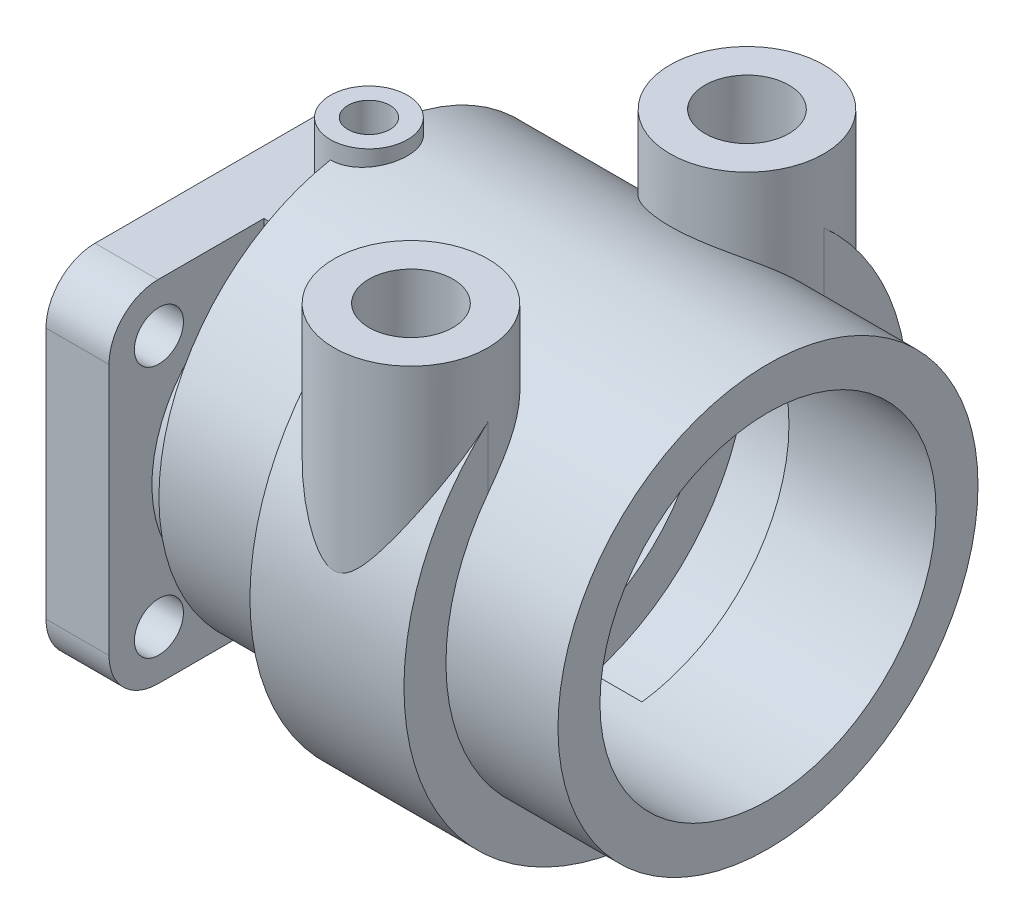
from build123d import *
from build123d.topology import SkipClean

# Parameters (mm, degrees)
SKETCH_1_R           = 3.5
EXTRUDE_1_DEPTH      = 9
SKETCH_2_R           = 19
CUT_EXTRUDE_1_DEPTH  = 5
SKETCH_3_R           = 19
EXTRUDE_2_DEPTH      = 12
SKETCH_4_R           = 11
CUT_EXTRUDE_2_DEPTH  = 22
SKETCH_6_R           = 30
EXTRUDE_4_DEPTH      = 57
SKETCH_9_R           = 24
CUT_EXTRUDE_3_DEPTH  = 51
SKETCH_10_R          = 11
CUT_EXTRUDE_4_DEPTH  = 22
EXTRUDE_5_DEPTH      = 42
EXTRUDE_5_DEPTH_BACK = 5
SKETCH_11_R          = 5.5
SKETCH_12_R          = 3
CUT_EXTRUDE_5_DEPTH  = 46
EXTRUDE_6_DEPTH      = 3
EXTRUDE_6_DEPTH_BACK = 3
SKETCH_13_W          = 9.793504726
SKETCH_13_H          = 10
SKETCH_14_R          = 11
EXTRUDE_7_DEPTH      = 46
SKETCH_15_R          = 11
EXTRUDE_8_DEPTH      = 46
SKETCH_16_R          = 5.5
CUT_EXTRUDE_6_DEPTH  = 46
SKETCH_17_R          = 5.5
CUT_EXTRUDE_8_DEPTH  = 53
SKETCH_18_R          = 11
CUT_EXTRUDE_9_DEPTH  = 10
SKETCH_19_R          = 11
CUT_EXTRUDE_10_DEPTH = 10
EXTRUDE_9_DEPTH      = 38
SKETCH_21_R          = 49.255208552
CUT_EXTRUDE_18_DEPTH = 16
SKETCH_22_R          = 30
EXTRUDE_10_DEPTH     = 16
SKETCH_23_R          = 24
CUT_EXTRUDE_19_DEPTH = 21
CUT_EXTRUDE_21_DEPTH = 12
SKETCH_25_R          = 24
CUT_EXTRUDE_22_DEPTH = 18.5
SKETCH_26_R          = 11
CUT_EXTRUDE_23_DEPTH = 31.5
SKETCH_27_R          = 6
CUT_EXTRUDE_24_DEPTH = 36
SKETCH_28_R          = 6
CUT_EXTRUDE_25_DEPTH = 36


with BuildPart() as part:
    # 草图1 → 凸台-拉伸1 (new body)
    with BuildSketch(Plane(origin=(0, 0, 0), x_dir=(0, 0, -1), z_dir=(1, 0, 0))):
        with BuildLine():
            Line((18.130000068, 25), (-18.130000068, 25))
            ThreePointArc((-18.130000068, 25), (-23.079747536, 22.949747468), (-25.130000068, 18))
            Line((-25.130000068, 18), (-25.130000068, -18))
            ThreePointArc((-25.130000068, -18), (-23.079747536, -22.949747468), (-18.130000068, -25))
            Line((-18.130000068, -25), (18.130000068, -25))
            ThreePointArc((18.130000068, -25), (23.079747536, -22.949747468), (25.130000068, -18))
            Line((25.130000068, -18), (25.130000068, 18))
            ThreePointArc((25.130000068, 18), (23.079747536, 22.949747468), (18.130000068, 25))
        make_face()
        with Locations((-18, 18)):
            Circle(SKETCH_1_R, mode=Mode.SUBTRACT)
        with Locations((-18, -18)):
            Circle(SKETCH_1_R, mode=Mode.SUBTRACT)
        with Locations((18, -18)):
            Circle(SKETCH_1_R, mode=Mode.SUBTRACT)
        with Locations((18, 18)):
            Circle(SKETCH_1_R, mode=Mode.SUBTRACT)
    extrude(amount=EXTRUDE_1_DEPTH)

    # 草图2 → 切除-拉伸1 (cut)
    with BuildSketch(Plane.ZY):
        Circle(SKETCH_2_R)
    extrude(amount=-CUT_EXTRUDE_1_DEPTH, mode=Mode.SUBTRACT)

    # 草图3 → 凸台-拉伸2 (add)
    with BuildSketch(Plane(origin=(9, 0, 0), x_dir=(0, 0, -1), z_dir=(1, 0, 0))):
        with Locations(Location((0, 0, 0), (0, 0, 180))):
            Circle(SKETCH_3_R)
    extrude(amount=EXTRUDE_2_DEPTH)

    # 草图4 → 切除-拉伸2 (cut)
    with BuildSketch(Plane.ZY.offset(-5)):
        Circle(SKETCH_4_R)
    extrude(amount=-CUT_EXTRUDE_2_DEPTH, mode=Mode.SUBTRACT)

    # 草图6 → 凸台-拉伸4 (add)
    with BuildSketch(Plane(origin=(21, 0, 0), x_dir=(0, 0, -1), z_dir=(1, 0, 0))):
        with Locations(Location((0, 10, 0), (0, 0, 180))):
            Circle(SKETCH_6_R)
    extrude(amount=EXTRUDE_4_DEPTH)

    # 草图9 → 切除-拉伸3 (cut)
    with BuildSketch(Plane(origin=(78, 0, 0), x_dir=(0, 0, -1), z_dir=(1, 0, 0))):
        with Locations((0, 10)):
            Circle(SKETCH_9_R)
    extrude(amount=-CUT_EXTRUDE_3_DEPTH, mode=Mode.SUBTRACT)

    # 草图10 → 切除-拉伸4 (cut)
    with BuildSketch(Plane.ZY.offset(-5)):
        Circle(SKETCH_10_R)
    extrude(amount=-CUT_EXTRUDE_4_DEPTH, mode=Mode.SUBTRACT)

    # 草图11 → 凸台-拉伸5 (add, two sides: drawn at the far end of the back side and taken through both)
    with BuildSketch(Plane(origin=(0, 0, 0), x_dir=(1, 0, 0), z_dir=(0, 1, 0)).offset(-EXTRUDE_5_DEPTH_BACK)):
        with Locations(Location((21, 0, 0), (0, 0, 270))):
            Circle(SKETCH_11_R)
    extrude(amount=EXTRUDE_5_DEPTH + EXTRUDE_5_DEPTH_BACK)

    # 草图12 → 切除-拉伸5 (cut)
    with BuildSketch(Plane(origin=(0, 42, 0), x_dir=(1, 0, 0), z_dir=(0, 1, 0))):
        with Locations(Location((21, 0, 0), (0, 0, 270))):
            Circle(SKETCH_12_R)
    extrude(amount=-CUT_EXTRUDE_5_DEPTH, mode=Mode.SUBTRACT)

    # 草图13 → 凸台-拉伸6 (add, two sides: drawn at the far end of the back side and taken through both)
    with BuildSketch(Plane.XY.offset(-EXTRUDE_6_DEPTH_BACK)):
        with Locations((11.546551794, 20)):
            Rectangle(SKETCH_13_W, SKETCH_13_H)
    extrude(amount=EXTRUDE_6_DEPTH + EXTRUDE_6_DEPTH_BACK)

    # 草图14 → 凸台-拉伸7 (add)
    with BuildSketch(Plane(origin=(0, 0, 0), x_dir=(1, 0, 0), z_dir=(0, 1, 0))):
        with Locations(Location((51, 24, 0), (0, 0, 157.077902143))):
            Circle(SKETCH_14_R)
    extrude(amount=EXTRUDE_7_DEPTH)

    # 草图15 → 凸台-拉伸8 (add)
    with BuildSketch(Plane(origin=(0, 0, 0), x_dir=(1, 0, 0), z_dir=(0, 1, 0))):
        with Locations(Location((51, -24, 0), (0, 0, 337.077902143))):
            Circle(SKETCH_15_R)
    extrude(amount=EXTRUDE_8_DEPTH)

    # 草图16 → 切除-拉伸6 (cut)
    with BuildSketch(Plane(origin=(0, 46, 0), x_dir=(1, 0, 0), z_dir=(0, 1, 0))):
        with Locations(Location((51, 24, 0), (0, 0, 270))):
            Circle(SKETCH_16_R)
    extrude(amount=-CUT_EXTRUDE_6_DEPTH, mode=Mode.SUBTRACT)

    # 草图17 → 切除-拉伸8 (cut)
    with BuildSketch(Plane(origin=(0, 0, 0), x_dir=(1, 0, 0), z_dir=(0, 1, 0))):
        with Locations(Location((51, -24, 0), (0, 0, 156.61972231))):
            Circle(SKETCH_17_R)
    extrude(amount=CUT_EXTRUDE_8_DEPTH, mode=Mode.SUBTRACT)

    # 草图18 → 切除-拉伸9 (cut)
    with BuildSketch(Plane(origin=(0, 0, 0), x_dir=(-1, 0, 0), z_dir=(0, -1, 0))):
        with Locations(Location((-51, 24, 0), (0, 0, 33.055731151))):
            Circle(SKETCH_18_R)
    extrude(amount=-CUT_EXTRUDE_9_DEPTH, mode=Mode.SUBTRACT)

    # 草图19 → 切除-拉伸10 (cut)
    with BuildSketch(Plane.XZ):
        with Locations(Location((51, 24, 0), (0, 0, 146.944273408))):
            Circle(SKETCH_19_R)
    extrude(amount=-CUT_EXTRUDE_10_DEPTH, mode=Mode.SUBTRACT)

    # 草图20 → 凸台-拉伸9 (add)
    with BuildSketch(Plane(origin=(78, 0, 0), x_dir=(0, 0, -1), z_dir=(1, 0, 0))):
        with BuildLine():
            Line((24, 22.024547777), (24, 36.83281573))
            ThreePointArc((24, 36.83281573), (24.504404278, 36.372981837), (25, 35.903667694))
            ThreePointArc((25, 35.903667694), (0, -26), (-25, 35.903667694))
            ThreePointArc((-25, 35.903667694), (-24.504404278, 36.372981837), (-24, 36.83281573))
            Line((-24, 36.83281573), (-24, 22.024547777))
            ThreePointArc((-24, 22.024547777), (0, 36.843802809), (24, 22.024547777))
        make_face()
    extrude(amount=-EXTRUDE_9_DEPTH)

    # 草图21 → 切除-拉伸18 (cut)
    with BuildSketch(Plane(origin=(78, 0, 0), x_dir=(0, 0, -1), z_dir=(1, 0, 0))):
        with Locations((2.047967506, 13.664850217)):
            Circle(SKETCH_21_R)
    extrude(amount=-CUT_EXTRUDE_18_DEPTH, mode=Mode.SUBTRACT)

    # 草图22 → 凸台-拉伸10 (add)
    with BuildSketch(Plane(origin=(62, 0, 0), x_dir=(0, 0, -1), z_dir=(1, 0, 0))):
        with Locations(Location((0, 10, 0), (0, 0, 100.563977589))):
            Circle(SKETCH_22_R)
    extrude(amount=EXTRUDE_10_DEPTH)

    # 草图23 → 切除-拉伸19 (cut)
    with BuildSketch(Plane(origin=(78, 0, 0), x_dir=(0, 0, -1), z_dir=(1, 0, 0))):
        with Locations((0, 10)):
            Circle(SKETCH_23_R)
    extrude(amount=-CUT_EXTRUDE_19_DEPTH, mode=Mode.SUBTRACT)

    # 草图24 → 切除-拉伸21 (cut)
    with BuildSketch(Plane(origin=(57, 0, 0), x_dir=(0, 0, -1), z_dir=(1, 0, 0))):
        with BuildLine():
            Line((24, 10), (24, 28))
            ThreePointArc((24, 28), (27.47083195, -2.056259452), (3, -19.849623113))
            Line((3, -19.849623113), (3, -13.8117618))
            ThreePointArc((3, -13.8117618), (0, -14), (-3, -13.8117618))
            Line((-3, -13.8117618), (-3, -16.918671249))
            Line((-3, -16.918671249), (-3, -19.849623113))
            ThreePointArc((-3, -19.849623113), (-27.47083195, -2.056259452), (-24, 28))
            Line((-24, 28), (-24, 10))
            ThreePointArc((-24, 10), (0, 34), (24, 10))
        make_face()
    extrude(amount=-CUT_EXTRUDE_21_DEPTH, mode=Mode.SUBTRACT)

    # 草图25 → 切除-拉伸22 (cut)
    with BuildSketch(Plane(origin=(45, 0, 0), x_dir=(0, 0, -1), z_dir=(1, 0, 0))):
        with Locations((0, 10)):
            Circle(SKETCH_25_R)
    extrude(amount=-CUT_EXTRUDE_22_DEPTH, mode=Mode.SUBTRACT)

    # 草图26 → 切除-拉伸23 (cut)
    with SkipClean():  # the faces are left unmerged after this step: merging them gives an invalid solid
        with BuildSketch(Plane.ZY.offset(-5)):
            Circle(SKETCH_26_R)
        extrude(amount=-CUT_EXTRUDE_23_DEPTH, mode=Mode.SUBTRACT)

    # 草图27 → 切除-拉伸24 (cut)
    with SkipClean():  # the faces are left unmerged after this step: merging them gives an invalid solid
        with BuildSketch(Plane(origin=(0, 46, 0), x_dir=(1, 0, 0), z_dir=(0, 1, 0))):
            with Locations(Location((51, -24, 0), (0, 0, 270))):
                Circle(SKETCH_27_R)
        extrude(amount=-CUT_EXTRUDE_24_DEPTH, mode=Mode.SUBTRACT)

    # 草图28 → 切除-拉伸25 (cut)
    with SkipClean():  # the faces are left unmerged after this step: merging them gives an invalid solid
        with BuildSketch(Plane(origin=(0, 46, 0), x_dir=(1, 0, 0), z_dir=(0, 1, 0))):
            with Locations(Location((51, 24, 0), (0, 0, 270))):
                Circle(SKETCH_28_R)
        extrude(amount=-CUT_EXTRUDE_25_DEPTH, mode=Mode.SUBTRACT)


solid = part.part
